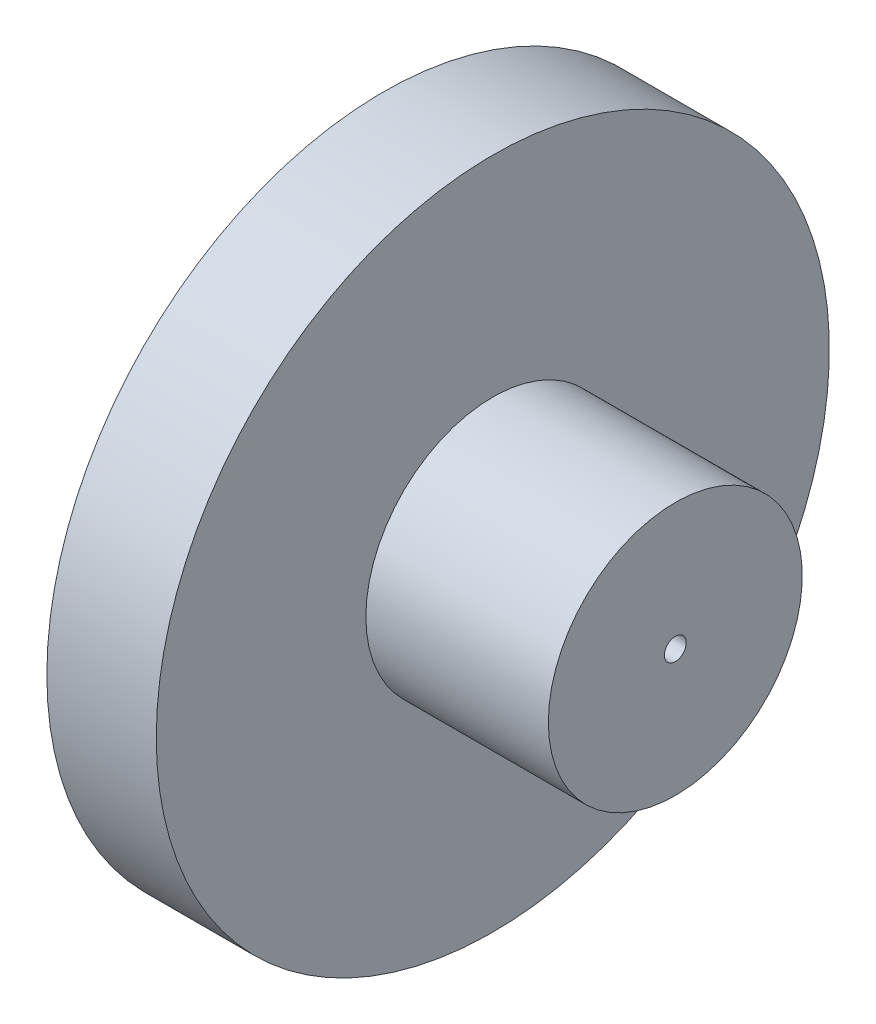
from build123d import *


with BuildPart() as part:
    # Sketch1 → Revolve1 (revolve)
    with BuildSketch(Plane.XY, mode=Mode.PRIVATE) as revolve1_sk:
        Polygon((-106, 5), (-106, 32.810148198), (-27.407709249, 32.810148198), (-27.407709249, 153.810148198), (22.592290751, 153.810148198), (22.592290751, 58.022786047), (106, 58.022786047), (106, 5), align=None)
    revolve(revolve1_sk.sketch.rotate(Axis((-37.411989194, 0, 0), (1, 0, 0)), 90), axis=Axis((-37.411989194, 0, 0), (1, 0, 0)))


solid = part.part
